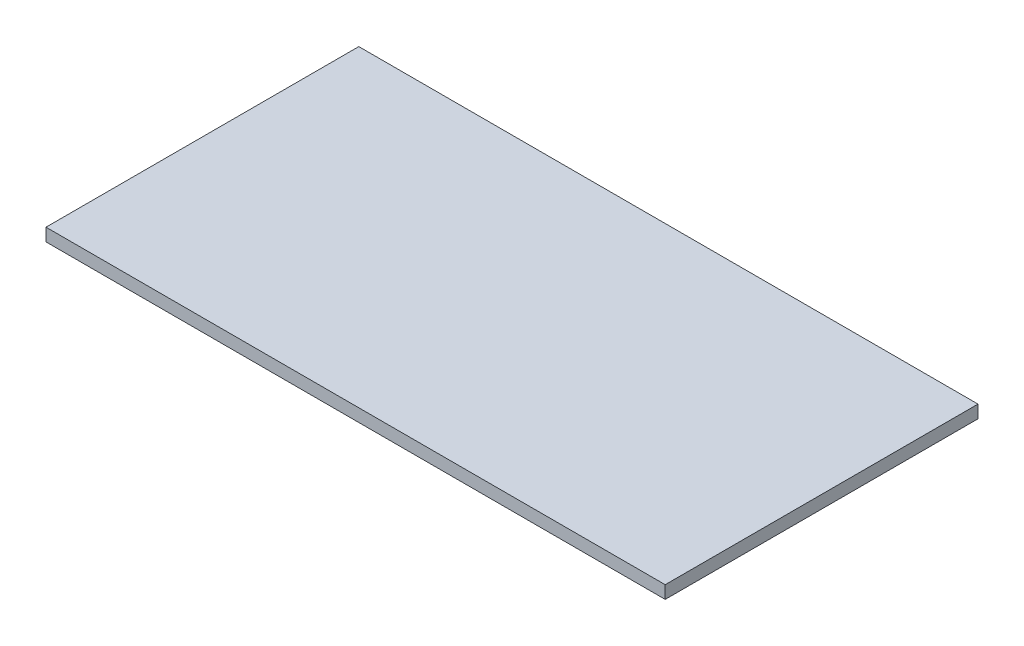
from build123d import *

# Parameters (mm, degrees)
SKETCH1_W           = 2463.8
SKETCH1_H           = 1244.6
BOSS_EXTRUDE1_DEPTH = 50.8


with BuildPart() as part:
    # Sketch1 → Boss-Extrude1 (new body)
    with BuildSketch(Plane(origin=(0, 0, 0), x_dir=(1, 0, 0), z_dir=(0, 1, 0))):
        with Locations((1231.9, 622.3)):
            Rectangle(SKETCH1_W, SKETCH1_H)
    extrude(amount=BOSS_EXTRUDE1_DEPTH)


solid = part.part
